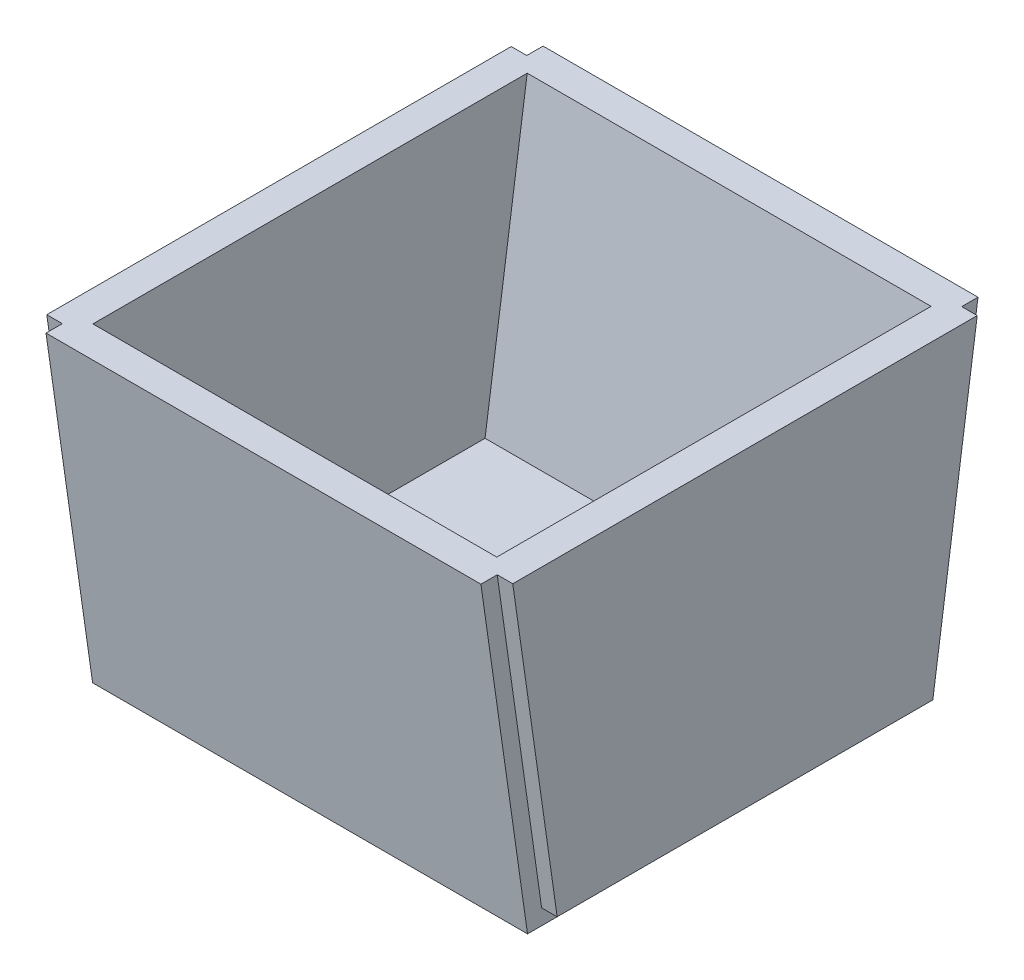
from build123d import *

# Parameters (mm, degrees)
SHELL1_T                 = -25.4
SHELL1_THICKNESS_2_DEPTH = 12.7
SHELL1_THICKNESS_3_DEPTH = 12.7
BOSS_EXTRUDE2_START      = -12.7
BOSS_EXTRUDE2_DEPTH      = 25.4
BOSS_EXTRUDE3_DEPTH      = 12.7


with BuildPart() as part:
    # Sketch1 → Loft1 section 0
    with BuildSketch(Plane(origin=(0, 0, 0), x_dir=(1, 0, 0), z_dir=(0, 1, 0))):
        with BuildLine():
            Line((-177.8, 165.1), (177.8, 165.1))
            Line((177.8, 165.1), (177.8, -165.1))
            Line((177.8, -165.1), (-177.8, -165.1))
            Line((-177.8, -165.1), (-177.8, 165.1))
        make_face()
    # Sketch2 → Loft1 section 1
    with BuildSketch(Plane(origin=(0, 266.7, 0), x_dir=(1, 0, 0), z_dir=(0, 1, 0))):
        with BuildLine():
            Line((-177.8, 203.2), (177.8, 203.2))
            Line((177.8, 203.2), (177.8, -203.2))
            Line((177.8, -203.2), (-177.8, -203.2))
            Line((-177.8, -203.2), (-177.8, 203.2))
        make_face()
    loft()

    # Shell1
    shell1_openings = [part.faces().sort_by_distance(p)[0] for p in [
        (0, 266.7, 0),
    ]]
    offset(amount=SHELL1_T, openings=shell1_openings, kind=Kind.INTERSECTION)

    # Shell1 thickness 2 face (on inner face of the shell) → Shell1 thickness 2 (cut)
    with BuildSketch(Plane(origin=(-152.4, 150.373987865, 0), x_dir=(0, 0, -1), z_dir=(-1, 0, 0))):
        Polygon((-143.070696797, 124.973987865), (143.070696797, 124.973987865), (177.542125368, -116.326012135), (-177.542125368, -116.326012135), align=None)
    extrude(amount=SHELL1_THICKNESS_2_DEPTH, mode=Mode.SUBTRACT)

    # Shell1 thickness 3 face (on inner face of the shell) → Shell1 thickness 3 (cut)
    with BuildSketch(Plane(origin=(152.4, 150.373987865, 0), x_dir=(0, 0, 1), z_dir=(1, 0, 0))):
        Polygon((177.542125368, -116.326012135), (-177.542125368, -116.326012135), (-143.070696797, 124.973987865), (143.070696797, 124.973987865), align=None)
    extrude(amount=SHELL1_THICKNESS_3_DEPTH, mode=Mode.SUBTRACT)

    # Sketch4 → Boss-Extrude2 (add)
    with BuildSketch(Plane(origin=(177.8, 0, 0), x_dir=(0, 0, -1), z_dir=(1, 0, 0)).offset(BOSS_EXTRUDE2_START)):
        Polygon((189.865, 266.7), (153.579285714, 12.7), (-153.579285714, 12.7), (-189.865, 266.7), align=None)
    extrude(amount=BOSS_EXTRUDE2_DEPTH)

    # Sketch5 → Boss-Extrude3 (add)
    with BuildSketch(Plane.ZY.offset(177.8)):
        Polygon((-153.579285714, 12.7), (153.579285714, 12.7), (189.865, 266.7), (-189.865, 266.7), align=None)
    extrude(amount=BOSS_EXTRUDE3_DEPTH)


solid = part.part
